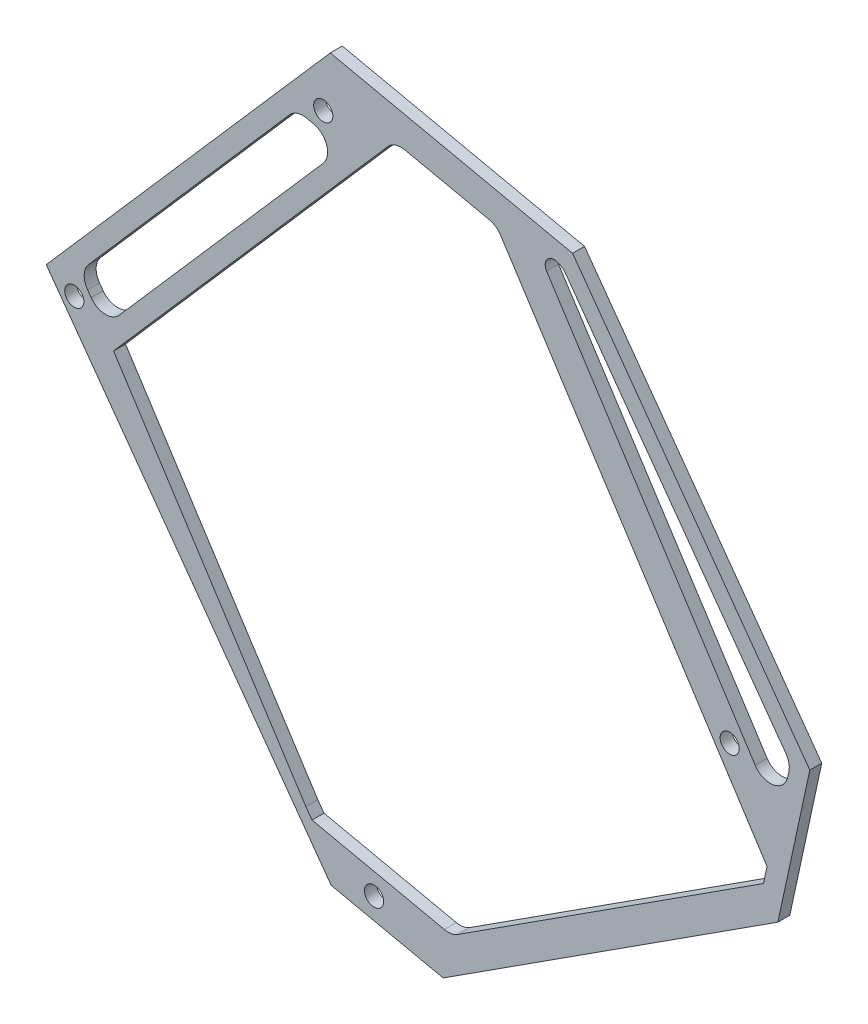
from build123d import *

# Parameters (mm, degrees)
SKETCH2_R           = 1.6
BOSS_EXTRUDE1_DEPTH = 2
CHAMFER1_SIZE       = 16
CHAMFER1_SIZE2      = 16.908072044
CUT_EXTRUDE1_DEPTH  = 2
CUT_EXTRUDE2_DEPTH  = 2
FILLET1_R           = 3
FILLET2_R           = 1.5
SKETCH5_R           = 1.6
CUT_EXTRUDE3_DEPTH  = 2


with BuildPart() as part:
    # Sketch2 → Boss-Extrude1 (new body)
    with BuildSketch(Plane.XY):
        Polygon((20.342311206, 18.763435595), (67.83529335, 73.163119739), (108.3419511, 64.404376963), (148.006657298, 9.405462998), (142.666805642, -15.289809939), (75.921402075, -58.302296892), align=None)
        with Locations((25.032859693, 16.533479235)):
            Circle(SKETCH2_R, mode=Mode.SUBTRACT)
        with Locations((66.656313732, 64.210054816)):
            Circle(SKETCH2_R, mode=Mode.SUBTRACT)
        with Locations((134.6128014, 6.607635241)):
            Circle(SKETCH2_R, mode=Mode.SUBTRACT)
        Polygon((140.259166073, -10.893068121), (140.856941108, -8.128531088), (95.641730286, 62.034989033), (78.595202191, 65.720954825), (31.596135929, 11.887014645), (63.750974908, -38.009837557), (74.675087949, -53.157166528), align=None, mode=Mode.SUBTRACT)
    extrude(amount=BOSS_EXTRUDE1_DEPTH)

    # Chamfer1
    chamfer1_edges = [part.edges().sort_by_distance(p)[0] for p in [
        (74.675087949, -53.157166528, 1),
    ]]
    chamfer1_side = [part.faces().sort_by_distance(p)[0] for p in [
        (107.467127011, -32.025117325, 1),
    ]]
    chamfer(chamfer1_edges, length=CHAMFER1_SIZE, length2=CHAMFER1_SIZE2, reference=chamfer1_side[0])

    # Sketch3 → Cut-Extrude1 (cut)
    with BuildSketch(Plane.XY.offset(2)):
        Polygon((67.984533977, -47.297069134), (86.714380981, -51.347018482), (75.921402075, -58.302296892), align=None)
    extrude(amount=-CUT_EXTRUDE1_DEPTH, mode=Mode.SUBTRACT)

    # Sketch4 → Cut-Extrude2 (cut)
    with BuildSketch(Plane.XY.offset(2)):
        Polygon((25.857368283, 20.518945125), (30.060999178, 14.690208293), (69.985569717, 60.420838986), (62.168846417, 62.111046782), align=None)
        Polygon((102.03518682, 62.698754981), (106.582335629, 61.715526322), (144.792131882, 8.733984336), (142.787091436, -0.538749114), align=None)
    extrude(amount=-CUT_EXTRUDE2_DEPTH, mode=Mode.SUBTRACT)

    # Fillet1
    fillet1_edges = [part.edges().sort_by_distance(p)[0] for p in [
        (78.595202191, 65.720954825, 1),
        (95.641730286, 62.034989033, 1),
        (88.124336223, -44.490118537, 1),
        (25.857368283, 20.518945125, 1),
        (62.168846417, 62.111046782, 1),
        (69.985569717, 60.420838986, 1),
        (30.060999178, 14.690208293, 1),
        (142.787091436, -0.538749114, 1),
        (106.582335629, 61.715526322, 1),
        (144.792131882, 8.733984336, 1),
    ]]
    fillet(fillet1_edges, radius=FILLET1_R)

    # Fillet2
    fillet2_edges = [part.edges().sort_by_distance(p)[0] for p in [
        (102.03518682, 62.698754981, 1),
    ]]
    fillet(fillet2_edges, radius=FILLET2_R)

    # Sketch5 → Cut-Extrude3 (cut)
    with BuildSketch(Plane.XY.offset(2)):
        with Locations((75.149933369, -45.265554274)):
            Circle(SKETCH5_R)
    extrude(amount=-CUT_EXTRUDE3_DEPTH, mode=Mode.SUBTRACT)


solid = part.part
